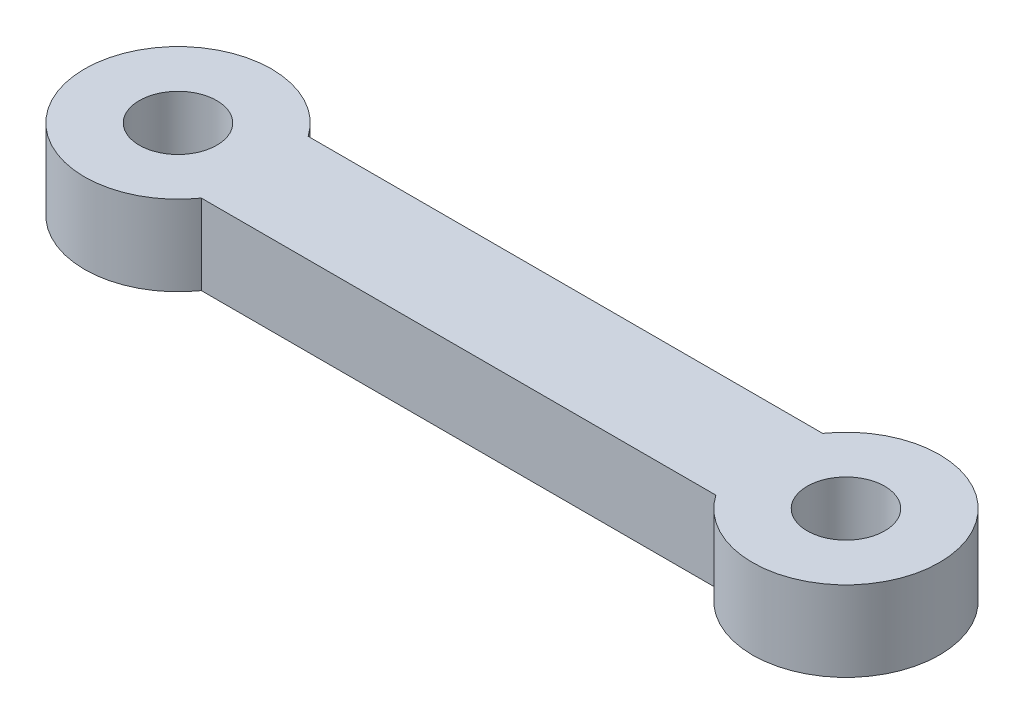
from build123d import *

# Parameters (mm, degrees)
SKETCH1_R           = 1.8415
BOSS_EXTRUDE1_DEPTH = 3.81


with BuildPart() as part:
    # Sketch1 → Boss-Extrude1 (new body)
    with BuildSketch(Plane(origin=(0, 0, 0), x_dir=(1, 0, 0), z_dir=(0, 1, 0))):
        with BuildLine():
            Line((3.647797281, 2.54), (28.102202719, 2.54))
            ThreePointArc((28.102202719, 2.54), (36.195, 0), (28.102202719, -2.54))
            Line((28.102202719, -2.54), (3.647797281, -2.54))
            ThreePointArc((3.647797281, -2.54), (-4.445, 0), (3.647797281, 2.54))
        make_face()
        with Locations(Location((0, 0, 0), (0, 0, 90))):
            Circle(SKETCH1_R, mode=Mode.SUBTRACT)
        with Locations(Location((31.75, 0, 0), (0, 0, 90))):
            Circle(SKETCH1_R, mode=Mode.SUBTRACT)
    extrude(amount=BOSS_EXTRUDE1_DEPTH)


solid = part.part
